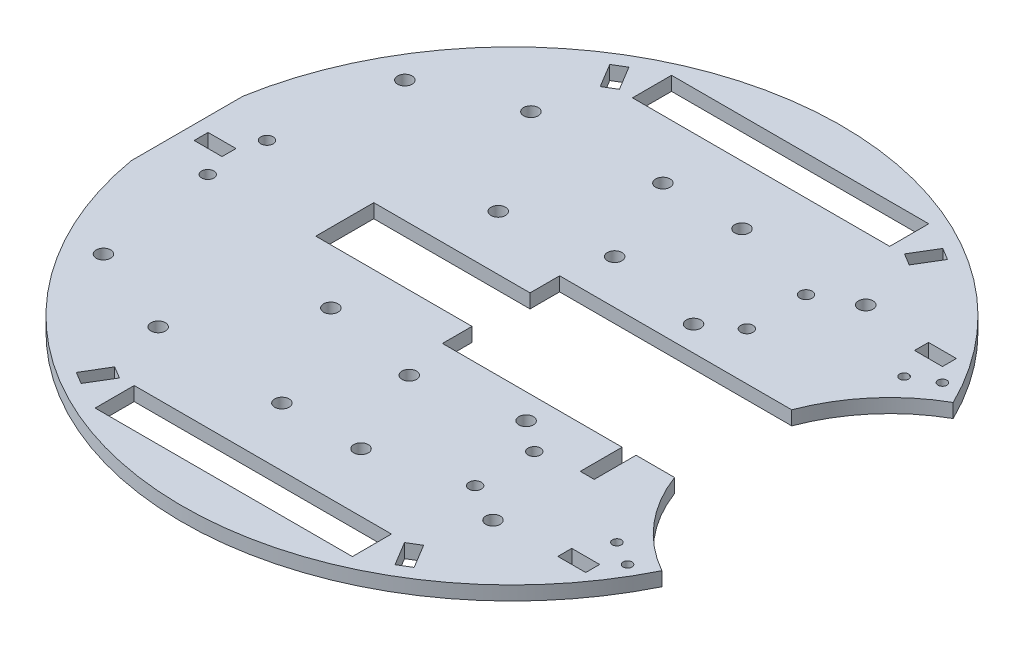
from build123d import *

# Parameters (mm, degrees)
SKETCH1_R           = 1.397
SKETCH1_R_2         = 1.651
SKETCH1_R_3         = 1.016
SKETCH1_W           = 58.544107304
SKETCH1_H           = 8.89
SKETCH1_W_2         = 6.35
SKETCH1_H_2         = 3.175
BOSS_EXTRUDE1_DEPTH = 3.175


with BuildPart() as part:
    # Sketch1 → Boss-Extrude1 (new body)
    with BuildSketch(Plane(origin=(0, 0, 0), x_dir=(1, 0, 0), z_dir=(0, 1, 0))):
        with BuildLine():
            Line((38.407265908, 13.335), (41.582265908, 13.335))
            Line((41.582265908, 13.335), (50.342102347, 13.335))
            ThreePointArc((50.342102347, 13.335), (57.058059725, 24.74076345), (67.270928268, 33.160552015))
            ThreePointArc((67.270928268, 33.160552015), (-10.756431789, 74.224653419), (-73.916912814, 12.7))
            Line((-73.916912814, 12.7), (-73.916912814, -12.7))
            ThreePointArc((-73.916912814, -12.7), (-10.756431789, -74.224653419), (67.270928268, -33.160552015))
            ThreePointArc((67.270928268, -33.160552015), (60.584216496, -28.355013333), (55.086193863, -22.225))
            ThreePointArc((55.086193863, -22.225), (52.41895011, -17.937530518), (50.342102347, -13.335))
            Line((50.342102347, -13.335), (46.281265908, -13.335))
            Line((46.281265908, -13.335), (41.582265908, -13.335))
            Line((41.582265908, -13.335), (41.582265908, -22.86))
            Line((41.582265908, -22.86), (38.407265908, -22.86))
            Line((38.407265908, -22.86), (38.407265908, -13.335))
            Line((38.407265908, -13.335), (-2.486734092, -13.335))
            Line((-2.486734092, -13.335), (-2.486734092, -6.604))
            Line((-2.486734092, -6.604), (-38.046734092, -6.604))
            Line((-38.046734092, -6.604), (-38.046734092, 6.604))
            Line((-38.046734092, 6.604), (-2.486734092, 6.604))
            Line((-2.486734092, 6.604), (-2.486734092, 13.335))
            Line((-2.486734092, 13.335), (38.407265908, 13.335))
        make_face()
        with Locations(Location((-62.486912814, 6.731, 0), (0, 0, 270))):
            Circle(SKETCH1_R, mode=Mode.SUBTRACT)
        with Locations(Location((-62.486912814, -6.731, 0), (0, 0, 270))):
            Circle(SKETCH1_R, mode=Mode.SUBTRACT)
        with Locations(Location((-38.1, -42.418, 0), (0, 0, 270))):
            Circle(SKETCH1_R_2, mode=Mode.SUBTRACT)
        with Locations(Location((38.1, -42.418, 0), (0, 0, 270))):
            Circle(SKETCH1_R_2, mode=Mode.SUBTRACT)
        with Locations(Location((38.1, 42.418, 0), (0, 0, 90))):
            Circle(SKETCH1_R_2, mode=Mode.SUBTRACT)
        with Locations(Location((0, -23.368, 0), (0, 0, 270))):
            Circle(SKETCH1_R_2, mode=Mode.SUBTRACT)
        with Locations(Location((-38.1, 42.418, 0), (0, 0, 90))):
            Circle(SKETCH1_R_2, mode=Mode.SUBTRACT)
        with Locations(Location((0, 23.368, 0), (0, 0, 90))):
            Circle(SKETCH1_R_2, mode=Mode.SUBTRACT)
        with Locations(Location((29.272053652, -37.649461806, 0), (0, 0, 270))):
            Circle(SKETCH1_R, mode=Mode.SUBTRACT)
        with Locations(Location((-58.676912814, 34.29, 0), (0, 0, 270))):
            Circle(SKETCH1_R_2, mode=Mode.SUBTRACT)
        with Locations(Location((62.141053559, -35.830642926, 0), (0, 0, 270))):
            Circle(SKETCH1_R_3, mode=Mode.SUBTRACT)
        with Locations(Location((56.570777105, -32.679132142, 0), (0, 0, 270))):
            Circle(SKETCH1_R_3, mode=Mode.SUBTRACT)
        with Locations(Location((-58.676912814, -34.29, 0), (0, 0, 270))):
            Circle(SKETCH1_R_2, mode=Mode.SUBTRACT)
        with Locations(Location((29.272053652, -24.187461806, 0), (0, 0, 270))):
            Circle(SKETCH1_R, mode=Mode.SUBTRACT)
        with Locations(Location((29.272053652, 37.649461806, 0), (0, 0, 90))):
            Circle(SKETCH1_R, mode=Mode.SUBTRACT)
        with Locations(Location((29.272053652, 24.187461806, 0), (0, 0, 90))):
            Circle(SKETCH1_R, mode=Mode.SUBTRACT)
        with Locations(Location((8.99925, -43.353461806, 0), (0, 0, 270))):
            Circle(SKETCH1_R_2, mode=Mode.SUBTRACT)
        with Locations(Location((-9.00075, -43.353461806, 0), (0, 0, 270))):
            Circle(SKETCH1_R_2, mode=Mode.SUBTRACT)
        with Locations(Location((-9.00075, 43.353461806, 0), (0, 0, 90))):
            Circle(SKETCH1_R_2, mode=Mode.SUBTRACT)
        with Locations(Location((8.99925, 43.353461806, 0), (0, 0, 90))):
            Circle(SKETCH1_R_2, mode=Mode.SUBTRACT)
        with Locations(Location((62.141053559, 35.830642926, 0), (0, 0, 270))):
            Circle(SKETCH1_R_3, mode=Mode.SUBTRACT)
        with Locations(Location((56.570777105, 32.679132142, 0), (0, 0, 270))):
            Circle(SKETCH1_R_3, mode=Mode.SUBTRACT)
        with Locations(Location((22.278265908, 19.05, 0), (0, 0, 270))):
            Circle(SKETCH1_R_2, mode=Mode.SUBTRACT)
        with Locations(Location((22.278265908, -19.05, 0), (0, 0, 270))):
            Circle(SKETCH1_R_2, mode=Mode.SUBTRACT)
        with Locations(Location((-22.171734092, -19.05, 0), (0, 0, 270))):
            Circle(SKETCH1_R_2, mode=Mode.SUBTRACT)
        with Locations(Location((-22.171734092, 19.05, 0), (0, 0, 270))):
            Circle(SKETCH1_R_2, mode=Mode.SUBTRACT)
        with Locations((0, -61.144461806)):
            Rectangle(SKETCH1_W, SKETCH1_H, mode=Mode.SUBTRACT)
        with Locations((0, 61.144461806)):
            Rectangle(SKETCH1_W, SKETCH1_H, mode=Mode.SUBTRACT)
        with Locations((55.791053559, -40.593142926)):
            Rectangle(SKETCH1_W_2, SKETCH1_H_2, mode=Mode.SUBTRACT)
        with Locations((55.791053559, 40.593142926)):
            Rectangle(SKETCH1_W_2, SKETCH1_H_2, mode=Mode.SUBTRACT)
        Polygon((32.44100721, -56.895314679), (35.719111901, -62.333745485), (38.438327304, -60.694693139), (35.160222613, -55.256262334), align=None, mode=Mode.SUBTRACT)
        Polygon((-32.44100721, -56.895314679), (-35.160222613, -55.256262334), (-38.438327304, -60.694693139), (-35.719111901, -62.333745485), align=None, mode=Mode.SUBTRACT)
        Polygon((-35.160222613, 55.256262334), (-38.438327304, 60.694693139), (-35.719111901, 62.333745485), (-32.44100721, 56.895314679), align=None, mode=Mode.SUBTRACT)
        Polygon((35.160222613, 55.256262334), (38.438327304, 60.694693139), (35.719111901, 62.333745485), (32.44100721, 56.895314679), align=None, mode=Mode.SUBTRACT)
        with Locations((-67.566912814, 0)):
            Rectangle(SKETCH1_W_2, SKETCH1_H_2, mode=Mode.SUBTRACT)
    extrude(amount=BOSS_EXTRUDE1_DEPTH)


solid = part.part
